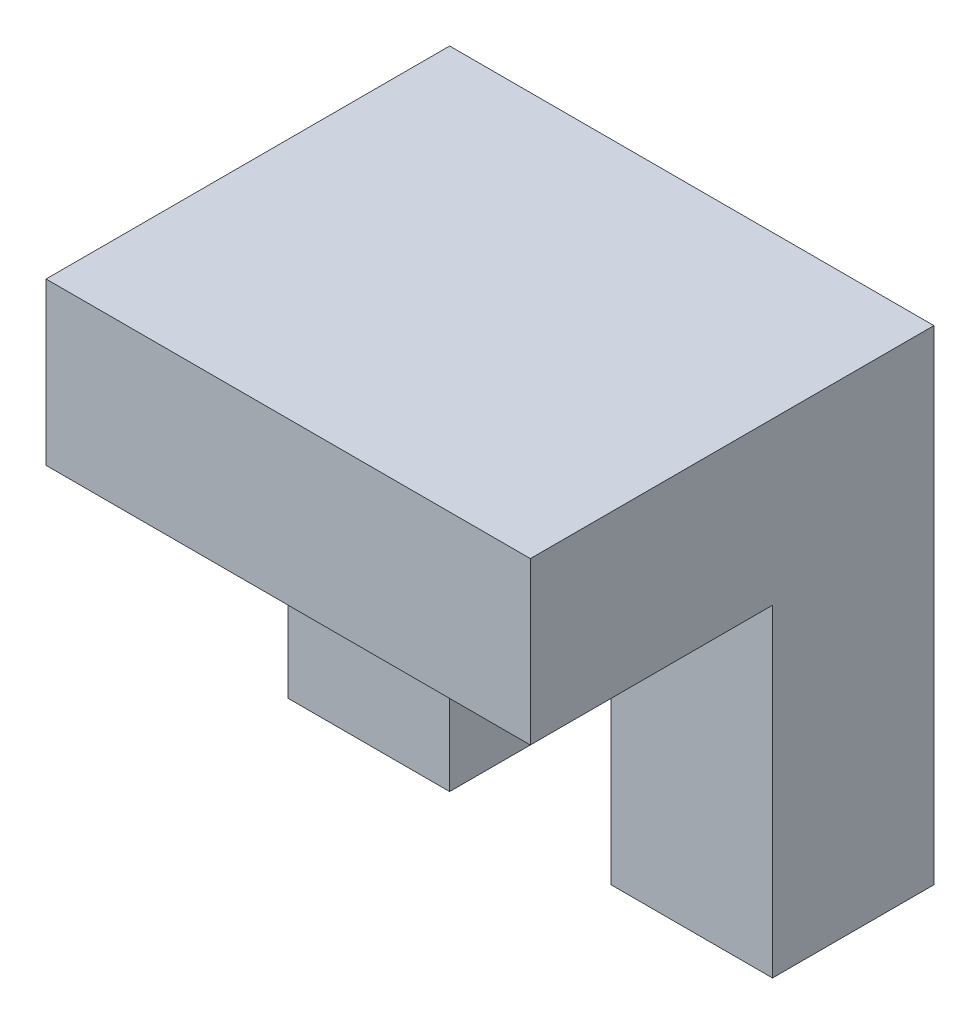
from build123d import *

# Parameters (mm, degrees)
ESBO_O1_W                = 60
ESBO_O1_H                = 40
RESSALTO_EXTRUS_O1_DEPTH = 20
ESBO_O8_W                = 20
ESBO_O8_H                = 20
CORTE_EXTRUS_O2_DEPTH    = 40
ESBO_O9_W                = 60
ESBO_O9_H                = 50
RESSALTO_EXTRUS_O2_DEPTH = 20


with BuildPart() as part:
    # Esboço1 → Ressalto-extrusão1 (new body)
    with BuildSketch(Plane.XY):
        with Locations((30, 20)):
            Rectangle(ESBO_O1_W, ESBO_O1_H)
    extrude(amount=RESSALTO_EXTRUS_O1_DEPTH)

    # Esboço8 → Corte-extrusão2 (cut)
    with BuildSketch(Plane.XY.offset(20)):
        with Locations((30, 10)):
            Rectangle(ESBO_O8_W, ESBO_O8_H)
    extrude(amount=-CORTE_EXTRUS_O2_DEPTH, mode=Mode.SUBTRACT)

    # Esboço9 → Ressalto-extrusão2 (add)
    with BuildSketch(Plane(origin=(0, 40, 0), x_dir=(1, 0, 0), z_dir=(0, 1, 0))):
        with Locations((30, -25)):
            Rectangle(ESBO_O9_W, ESBO_O9_H)
    extrude(amount=RESSALTO_EXTRUS_O2_DEPTH)


solid = part.part
